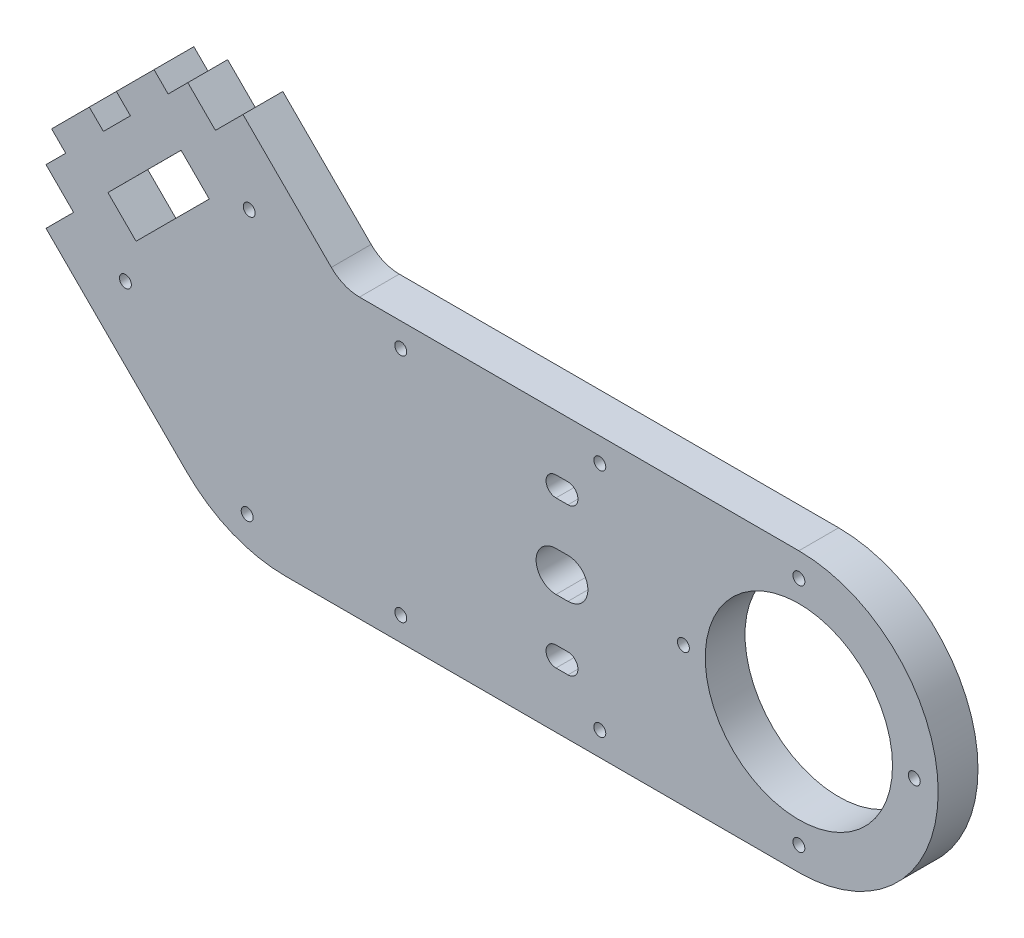
from build123d import *

# Parameters (mm, degrees)
SKETCH1_R           = 23.525
SKETCH1_R_2         = 1.5
BOSS_EXTRUDE1_DEPTH = 10


with BuildPart() as part:
    # Sketch1 → Boss-Extrude1 (new body)
    with BuildSketch(Plane.XY):
        with BuildLine():
            Line((0, -35), (-129, -35))
            ThreePointArc((-129, -35), (-142.388025128, -32.338224799), (-153.739712354, -24.757759039))
            Line((-153.739712354, -24.757759039), (-189.107939553, 10.584687182))
            Line((-189.107939553, 10.584687182), (-182.180820093, 17.516859712))
            Line((-182.180820093, 17.516859712), (-189.112992624, 24.443979172))
            Line((-189.112992624, 24.443979172), (-184.165050154, 29.395530979))
            Line((-184.165050154, 29.395530979), (-187.701872873, 32.929775601))
            Line((-187.701872873, 32.929775601), (-178.230097286, 42.408460491))
            Line((-178.230097286, 42.408460491), (-174.693274566, 38.874215869))
            Line((-174.693274566, 38.874215869), (-167.907524892, 45.664915491))
            Line((-167.907524892, 45.664915491), (-171.444347612, 49.199160113))
            Line((-171.444347612, 49.199160113), (-161.972572025, 58.677845002))
            Line((-161.972572025, 58.677845002), (-158.435749305, 55.14360038))
            Line((-158.435749305, 55.14360038), (-153.487806834, 60.095152188))
            Line((-153.487806834, 60.095152188), (-146.555634303, 53.168032728))
            Line((-146.555634303, 53.168032728), (-139.628514844, 60.100205259))
            Line((-139.628514844, 60.100205259), (-117.439262294, 37.927127131))
            ThreePointArc((-117.439262294, 37.927127131), (-114.195654931, 35.760716243), (-110.37, 35))
            Line((-110.37, 35), (0, 35))
            ThreePointArc((0, 35), (35, 0), (0, -35))
        make_face()
        Circle(SKETCH1_R, mode=Mode.SUBTRACT)
        with Locations((29, 0)):
            Circle(SKETCH1_R_2, mode=Mode.SUBTRACT)
        with Locations((0, 29)):
            Circle(SKETCH1_R_2, mode=Mode.SUBTRACT)
        with Locations((0, -29)):
            Circle(SKETCH1_R_2, mode=Mode.SUBTRACT)
        with Locations((-50, -29)):
            Circle(SKETCH1_R_2, mode=Mode.SUBTRACT)
        with Locations((-50, 29)):
            Circle(SKETCH1_R_2, mode=Mode.SUBTRACT)
        with Locations((-100, -29)):
            Circle(SKETCH1_R_2, mode=Mode.SUBTRACT)
        with Locations((-100, 29)):
            Circle(SKETCH1_R_2, mode=Mode.SUBTRACT)
        with Locations((-29, 0)):
            Circle(SKETCH1_R_2, mode=Mode.SUBTRACT)
        with Locations((-169.166963878, 9.036324012)):
            Circle(SKETCH1_R_2, mode=Mode.SUBTRACT)
        with Locations((-138.065609793, 40.160362537)):
            Circle(SKETCH1_R_2, mode=Mode.SUBTRACT)
        with Locations((-138.576564013, -26.311393382)):
            Circle(SKETCH1_R_2, mode=Mode.SUBTRACT)
        with BuildLine():
            Line((-58, -5), (-61, -5))
            ThreePointArc((-61, -5), (-66, 0), (-61, 5))
            Line((-61, 5), (-58, 5))
            ThreePointArc((-58, 5), (-53, 0), (-58, -5))
        make_face(mode=Mode.SUBTRACT)
        with BuildLine():
            Line((-58, 16), (-61, 16))
            ThreePointArc((-61, 16), (-63.5, 18.5), (-61, 21))
            Line((-61, 21), (-58, 21))
            ThreePointArc((-58, 21), (-55.5, 18.5), (-58, 16))
        make_face(mode=Mode.SUBTRACT)
        with BuildLine():
            Line((-58, -21), (-61, -21))
            ThreePointArc((-61, -21), (-63.5, -18.5), (-61, -16))
            Line((-61, -16), (-58, -16))
            ThreePointArc((-58, -16), (-55.5, -18.5), (-58, -21))
        make_face(mode=Mode.SUBTRACT)
        Polygon((-173.557263216, 26.146707149), (-155.179191181, 44.538185292), (-148.108123369, 37.46711748), (-166.492898458, 19.082342391), align=None, mode=Mode.SUBTRACT)
    extrude(amount=BOSS_EXTRUDE1_DEPTH)


solid = part.part
